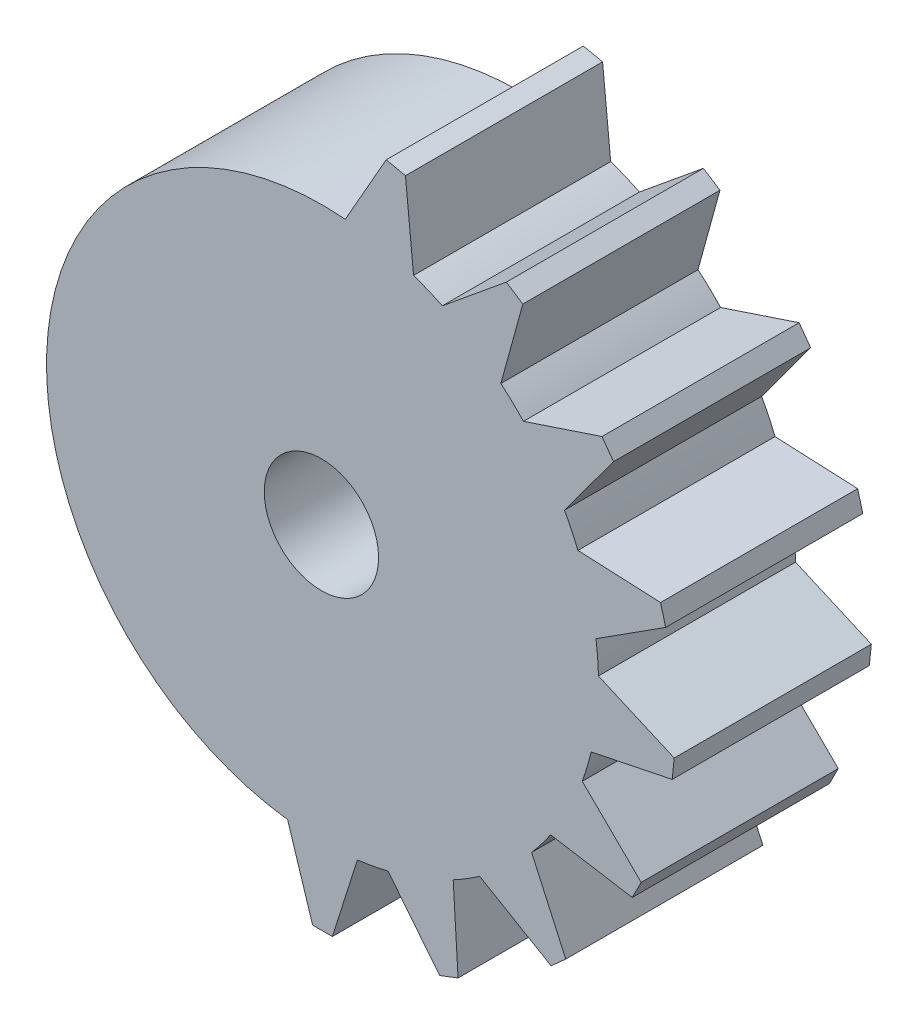
from build123d import *

# Parameters (mm, degrees)
SKETCH1_R           = 7
BOSS_EXTRUDE1_DEPTH = 5
BOSS_EXTRUDE2_DEPTH = 5
CIRPATTERN3_COUNT   = 9
CIRPATTERN3_ANGLE   = 168
CUT_EXTRUDE1_START  = -3.5
SKETCH5_R           = 1.45
CUT_EXTRUDE1_DEPTH  = 3.5


with BuildPart() as part:
    # Sketch1 → Boss-Extrude1 (new body)
    with BuildSketch(Plane.XY):
        with Locations((0.027853283, 0.035186328)):
            Circle(SKETCH1_R)
        with BuildLine():
            Line((0.20260938, -1.435774857), (1.443945142, 0.132372307))
            ThreePointArc((1.443945142, 0.132372307), (-1.136906694, 0.899968427), (0.20260938, -1.435774857))
        make_face(mode=Mode.SUBTRACT)
    extrude(amount=BOSS_EXTRUDE1_DEPTH)

    # Sketch3 → Boss-Extrude2 (add)
    with BuildSketch(Plane(origin=(0, 0, 0), x_dir=(-1, 0, 0), z_dir=(0, 0, -1))):
        Polygon((0.857146717, -6.908643667), (-0.912853283, -6.908643667), (-0.277853283, -8.908643667), (0.222146717, -8.908643667), align=None)
    boss_extrude2 = extrude(amount=-BOSS_EXTRUDE2_DEPTH)

    # CirPattern3: Boss-Extrude2 ×9 about axis
    cirpattern3_axis = Axis((0.027853283, 0.035186328, 0), (0, 0, 1))
    for i in range(1, CIRPATTERN3_COUNT):
        add(boss_extrude2.rotate(cirpattern3_axis, i * CIRPATTERN3_ANGLE / (CIRPATTERN3_COUNT - 1)))

    # Sketch5 → Cut-Extrude1 (cut)
    with BuildSketch(Plane.XY.offset(5).offset(CUT_EXTRUDE1_START)):
        with Locations(Location((0, 0, 0), (0, 0, 278.032257946))):
            Circle(SKETCH5_R)
    extrude(amount=CUT_EXTRUDE1_DEPTH, mode=Mode.SUBTRACT)


solid = part.part
